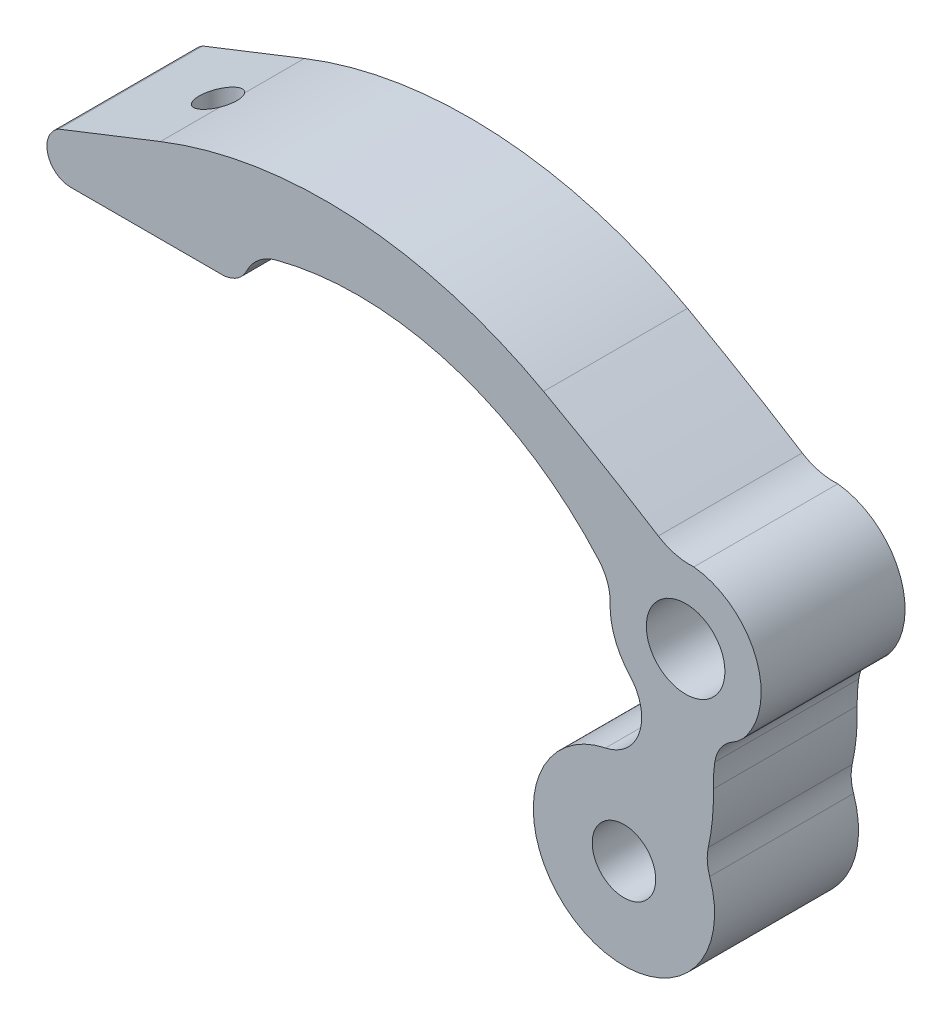
from build123d import *

# Parameters (mm, degrees)
BOSS_EXTRUDE1_DEPTH            = 9.525
F_5_2_5_2_DIAMETER_HOLE1_D     = 5.2
F_4_2_4_2_DIAMETER_HOLE1_D     = 4.2
F_2_5_2_5_DIAMETER_HOLE1_D     = 2.5
F_2_5_2_5_DIAMETER_HOLE1_DEPTH = 7.667982396


with BuildPart() as part:
    # Sketch1 → Boss-Extrude1 (new body)
    with BuildSketch(Plane(origin=(0, 0, 0.0762), x_dir=(-1, 0, 0), z_dir=(0, 0, -1))):
        with BuildLine():
            Line((-9.412617214, 46.18458545), (0.587382786, 46.18458545))
            ThreePointArc((0.587382786, 46.18458545), (2.110476578, 47.353297027), (1.375792677, 49.126977103))
            Line((1.375792677, 49.126977103), (-5.351179793, 51.776567317))
            ThreePointArc((-5.351179793, 51.776567317), (-18.213654114, 53.790284286), (-30.709315287, 50.135595029))
            ThreePointArc((-30.709315287, 50.135595029), (-34.537024445, 47.94381083), (-38.300389687, 45.643298402))
            ThreePointArc((-38.300389687, 45.643298402), (-39.429298758, 45.158647975), (-40.652811507, 45.047570171))
            ThreePointArc((-40.652811507, 45.047570171), (-44.686309378, 42.085440442), (-44.132804376, 37.111815022))
            ThreePointArc((-44.132804376, 37.111815022), (-43.716518775, 36.654265458), (-43.215241162, 36.291820896))
            ThreePointArc((-43.215241162, 36.291820896), (-42.428281445, 35.560296453), (-42.040186752, 34.558390211))
            ThreePointArc((-42.040186752, 34.558390211), (-41.957032136, 33.760744193), (-41.937117029, 32.959022765))
            ThreePointArc((-41.937117029, 32.959022765), (-41.88143503, 31.193095612), (-41.60760357, 29.447639934))
            ThreePointArc((-41.60760357, 29.447639934), (-41.541656296, 28.62951348), (-41.699906943, 27.824133651))
            ThreePointArc((-41.699906943, 27.824133651), (-33.057909903, 20.65839923), (-34.807142386, 31.747675507))
            ThreePointArc((-34.807142386, 31.747675507), (-37.051659352, 33.760582292), (-36.413760604, 36.707230442))
            ThreePointArc((-36.413760604, 36.707230442), (-35.419836056, 38.33724075), (-35.109301279, 40.220957226))
            ThreePointArc((-35.109301279, 40.220957226), (-34.933115189, 41.323470745), (-34.365977773, 42.285204986))
            ThreePointArc((-34.365977773, 42.285204986), (-24.606791119, 48.588208914), (-12.991191822, 48.806006202))
            ThreePointArc((-12.991191822, 48.806006202), (-11.85169268, 48.221904682), (-11.059558102, 47.215845196))
            ThreePointArc((-11.059558102, 47.215845196), (-10.384202381, 46.46367337), (-9.412617214, 46.18458545))
        make_face()
    extrude(amount=-BOSS_EXTRUDE1_DEPTH)

    # Ø5.2 (5.2) Diameter Hole1 (through all)
    with Locations(Plane.XY.offset(9.6012)):
        with Locations((40.107240677, 40.077424049)):
            Hole(F_5_2_5_2_DIAMETER_HOLE1_D / 2)

    # Ø4.2 (4.2) Diameter Hole1 (through all)
    with Locations(Plane.XY.offset(9.6012)):
        with Locations((36.026082039, 25.872797966)):
            Hole(F_4_2_4_2_DIAMETER_HOLE1_D / 2)

    # Ø2.5 (2.5) Diameter Hole1
    with Locations(Plane(origin=(0, 46.18458545, 0), x_dir=(-1, 0, 0), z_dir=(0, -1, 0))):
        with Locations((-4.401993155, -4.8387)):
            Hole(F_2_5_2_5_DIAMETER_HOLE1_D / 2, depth=F_2_5_2_5_DIAMETER_HOLE1_DEPTH)


solid = part.part
